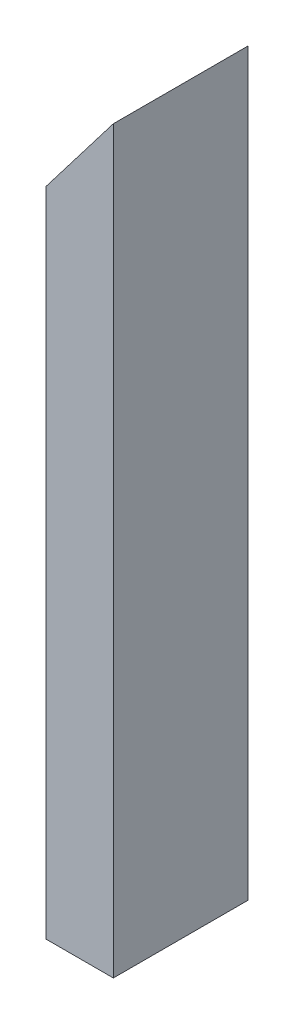
from build123d import *

# Parameters (mm, degrees)
EXTRUDE1_DEPTH                    = 25.4
F_10_24_TAPPED_HOLE1_D            = 3.7973
F_10_24_TAPPED_HOLE1_DEPTH        = 6.604
F_10_24_TAPPED_HOLE1_CBORE_D      = 4.826
F_10_24_TAPPED_HOLE1_CBORE_DEPTH  = 3.302
F_10_24_TAPPED_HOLE1_TIP          = 1.140824014
F_1_4_20_TAPPED_HOLE2_D           = 5.1054
F_1_4_20_TAPPED_HOLE2_DEPTH       = 16.51
F_1_4_20_TAPPED_HOLE2_CBORE_D     = 6.35
F_1_4_20_TAPPED_HOLE2_CBORE_DEPTH = 12.7
F_1_4_20_TAPPED_HOLE2_TIP         = 1.533816902


with BuildPart() as part:
    # Sketch1 → Extrude1 (new body)
    with BuildSketch(Plane.XY):
        Polygon((-6.35, 51.987941466), (6.35, 68.580838747), (6.35, -71.008376889), (-6.35, -71.008376889), align=None)
    extrude(amount=EXTRUDE1_DEPTH)

    # #10-24 Tapped Hole1
    with Locations(Plane(origin=(-37.120191611, 11.785844717, 18.061260674), x_dir=(0.6077917109691768, 0.7940964904072809, 0), z_dir=(-0.7940964904072809, 0.6077917109691768, 0))):
        with Locations((59.446155795, 5.361260674)):
            CounterBoreHole(F_10_24_TAPPED_HOLE1_D / 2, F_10_24_TAPPED_HOLE1_CBORE_D / 2, F_10_24_TAPPED_HOLE1_CBORE_DEPTH, depth=F_10_24_TAPPED_HOLE1_DEPTH)
            with Locations((0, 0, -(F_10_24_TAPPED_HOLE1_DEPTH + F_10_24_TAPPED_HOLE1_TIP / 2))):  # 118° drill point
                Cone(0, F_10_24_TAPPED_HOLE1_D / 2, F_10_24_TAPPED_HOLE1_TIP, mode=Mode.SUBTRACT)

    # 1/4-20 Tapped Hole2
    with Locations(Plane(origin=(-43.496001464, -71.008376889, 18.061260674), x_dir=(-1, 0, 0), z_dir=(0, -1, 0))):
        with Locations((-43.492926523, 5.361260674)):
            CounterBoreHole(F_1_4_20_TAPPED_HOLE2_D / 2, F_1_4_20_TAPPED_HOLE2_CBORE_D / 2, F_1_4_20_TAPPED_HOLE2_CBORE_DEPTH, depth=F_1_4_20_TAPPED_HOLE2_DEPTH)
            with Locations((0, 0, -(F_1_4_20_TAPPED_HOLE2_DEPTH + F_1_4_20_TAPPED_HOLE2_TIP / 2))):  # 118° drill point
                Cone(0, F_1_4_20_TAPPED_HOLE2_D / 2, F_1_4_20_TAPPED_HOLE2_TIP, mode=Mode.SUBTRACT)


solid = part.part
